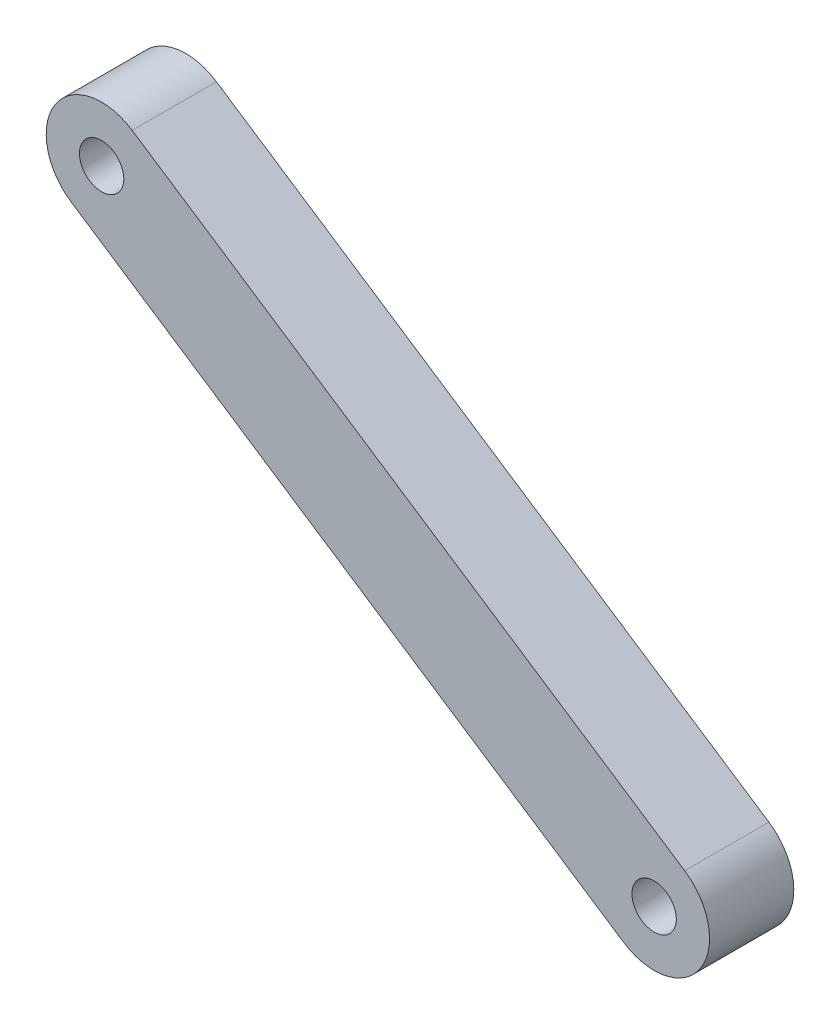
from build123d import *

# Parameters (mm, degrees)
SKETCH1_R           = 1
BOSS_EXTRUDE1_DEPTH = 3.8


with BuildPart() as part:
    # Sketch1 → Boss-Extrude1 (new body)
    with BuildSketch(Plane.XY):
        with BuildLine():
            Line((-15.782928594, 51.388887197), (9.139604606, 34.926906717))
            ThreePointArc((9.139604606, 34.926906717), (9.847753863, 31.46301806), (6.383865206, 30.754868803))
            Line((6.383865206, 30.754868803), (-18.538667994, 47.216849283))
            ThreePointArc((-18.538667994, 47.216849283), (-19.246817251, 50.68073794), (-15.782928594, 51.388887197))
        make_face()
        with Locations(Location((-17.160798294, 49.30286824, 0), (0, 0, 180))):
            Circle(SKETCH1_R, mode=Mode.SUBTRACT)
        with Locations(Location((7.761734906, 32.84088776, 0), (0, 0, 180))):
            Circle(SKETCH1_R, mode=Mode.SUBTRACT)
    extrude(amount=BOSS_EXTRUDE1_DEPTH)


solid = part.part
